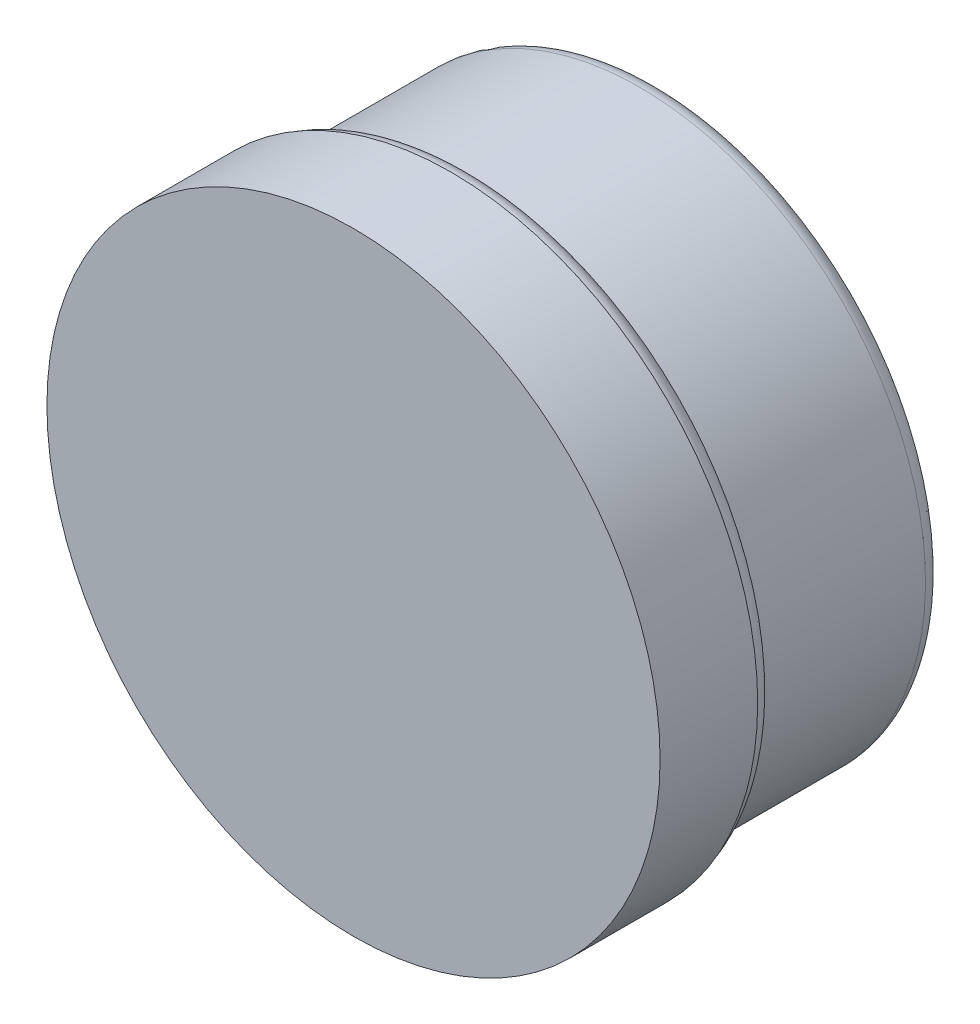
from build123d import *

# Parameters (mm, degrees)
BOSS_EXTRUDE3_DEPTH = 1.6


with BuildPart() as part:
    # Sketch4 → Revolve1 (revolve)
    with BuildSketch(Plane.YZ):
        with BuildLine():
            Line((0, 0), (30.55, 0))
            ThreePointArc((30.55, 0), (32.03492424, 0.61507576), (32.65, 2.1))
            Line((32.65, 2.1), (32.65, 21.5))
            Line((32.65, 21.5), (32.85, 21.5))
            ThreePointArc((32.85, 21.5), (34.264213562, 22.085786438), (34.85, 23.5))
            Line((34.85, 23.5), (34.85, 23.55))
            Line((34.85, 23.55), (32.65, 23.55))
            Line((32.65, 23.55), (32.65, 26.5))
            Line((32.65, 26.5), (33.25, 26.5))
            Line((33.25, 26.5), (33.25, 27.7))
            Line((33.25, 27.7), (32.65, 27.7))
            Line((32.65, 27.7), (32.65, 29))
            Line((32.65, 29), (31.15, 29))
            Line((31.15, 29), (31.15, 3))
            ThreePointArc((31.15, 3), (30.710660172, 1.939339828), (29.65, 1.5))
            Line((29.65, 1.5), (0, 1.5))
            Line((0, 1.5), (0, 0))
        make_face()
    revolve(axis=Axis((0, 0, 1.5), (0, 0, -1)))


with BuildPart() as body_2:
    # Sketch6 → Revolve2 (revolve)
    with BuildSketch(Plane.YZ):
        Polygon((0, 33.3), (0, 34.8), (35.025, 34.8), (35.025, 23.65), (33.275, 23.65), (33.275, 25.05), (32.775, 25.05), (32.775, 26.05), (33.275, 26.05), (33.275, 33.3), align=None)
    revolve(axis=Axis((0, 0, 33.3), (0, 0, 1)))

    # Sketch7 → Boss-Extrude3 (add)
    with BuildSketch(Plane(origin=(0, 0, 23.65), x_dir=(1, 0, 0), z_dir=(0, 0, -1))):
        with BuildLine():
            ThreePointArc((9.85, 33.611428488), (0, 35.025), (-9.85, 33.611428488))
            ThreePointArc((-9.85, 33.611428488), (-9.56498134, 35.524945793), (-8, 36.662318871))
            ThreePointArc((-8, 36.662318871), (0, 37.525), (8, 36.662318871))
            ThreePointArc((8, 36.662318871), (9.56498134, 35.524945793), (9.85, 33.611428488))
        make_face()
    extrude(amount=-BOSS_EXTRUDE3_DEPTH)


solid = Compound([part.part, body_2.part])
